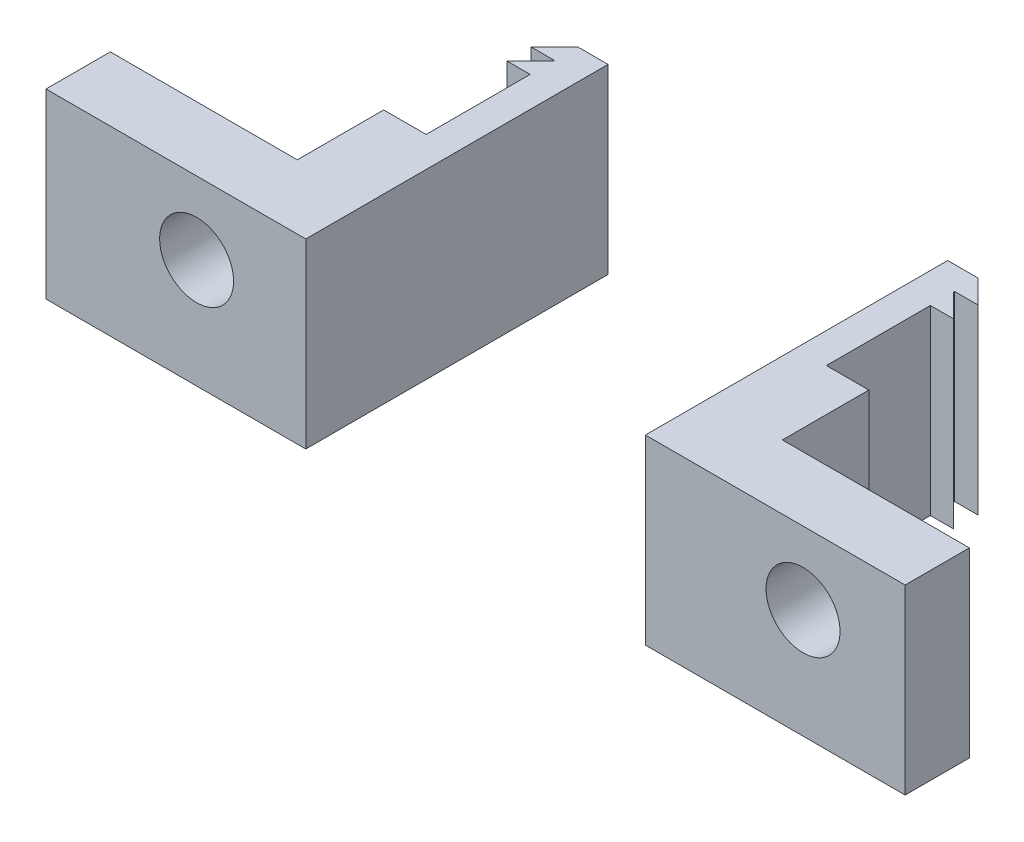
from build123d import *

# Parameters (mm, degrees)
BOSS_EXTRUDE1_DEPTH = 15
SKETCH3_R           = 3.05
CUT_EXTRUDE1_DEPTH  = 15
CUT_EXTRUDE2_DEPTH  = 59.485528143
SKETCH5_R           = 6
CUT_EXTRUDE3_DEPTH  = 10
SKETCH6_W           = 24.925
SKETCH6_H           = 15
BOSS_EXTRUDE2_DEPTH = 1
SKETCH7_W           = 24.925
SKETCH7_H           = 15
BOSS_EXTRUDE3_DEPTH = 1


with BuildPart() as part:
    # Sketch2 → Boss-Extrude1 (new body)
    with BuildSketch(Plane(origin=(0, 0, 0), x_dir=(1, 0, 0), z_dir=(0, 1, 0))):
        Polygon((-13.5, 0), (6.5, 0), (11.5, -5), (11.5, -41), (31.917309801, -41), (31.917309801, -35.69895288), (16.5, -35.69895288), (16.5, 5), (-23.5, 5), (-23.5, -35.69895288), (-38.917309801, -35.69895288), (-38.917309801, -41), (-18.5, -41), (-18.5, -5), align=None)
    extrude(amount=BOSS_EXTRUDE1_DEPTH)

    # Sketch3 → Cut-Extrude1 (cut)
    with BuildSketch(Plane(origin=(0, 0, 35.69895288), x_dir=(-1, 0, 0), z_dir=(0, 0, -1))):
        with Locations((26.5, 9)):
            Circle(SKETCH3_R)
        with Locations((-23.5, 9)):
            Circle(SKETCH3_R)
    extrude(amount=-CUT_EXTRUDE1_DEPTH, mode=Mode.SUBTRACT)

    # Sketch4 → Cut-Extrude2 (cut, through all)
    with BuildSketch(Plane(origin=(0, 15, 0), x_dir=(1, 0, 0), z_dir=(0, 1, 0))):
        Polygon((-20, -16.075), (-18.422599161, -16.075), (11.422599161, -16.075), (13, -16.075), (14.925, -18), (13, -18), (13, -18.075), (14.925, -20), (13, -20), (13, -28.575), (16.5, -28.575), (24.862996202, -28.575), (24.862996202, 6.300085517), (-33.250787424, 6.300085517), (-33.250787424, -28.575), (-23.5, -28.575), (-20, -28.575), (-20, -20), (-21.925, -20), (-20, -18.075), (-20, -18), (-21.925, -18), align=None)
    extrude(amount=-CUT_EXTRUDE2_DEPTH, mode=Mode.SUBTRACT)


with BuildPart() as cut_extrude2_piece_1:
    # of the separate pieces the step leaves, piece 1, a body of its own (cut_extrude2_pieces)
    add(part.part.solids().sort_by_distance((11.5, 0, 16.075))[0])

    # Sketch7 → Boss-Extrude3 (add)
    with BuildSketch(Plane.ZY.offset(-11.5)):
        with Locations((28.5375, 7.5)):
            Rectangle(SKETCH7_W, SKETCH7_H)
    extrude(amount=BOSS_EXTRUDE3_DEPTH)


with BuildPart() as cut_extrude2_piece_2:
    # of the separate pieces the step leaves, piece 2, a body of its own (cut_extrude2_pieces)
    add(part.part.solids().sort_by_distance((-18.5, 0, 41))[0])

    # Sketch5 → Cut-Extrude3 (cut)
    with BuildSketch(Plane(origin=(0, 0, 35.69895288), x_dir=(-1, 0, 0), z_dir=(0, 0, -1))):
        with Locations((26.5, 9)):
            Circle(SKETCH5_R)
    extrude(amount=CUT_EXTRUDE3_DEPTH, mode=Mode.SUBTRACT)

    # Sketch6 → Boss-Extrude2 (add)
    with BuildSketch(Plane(origin=(-18.5, 0, 0), x_dir=(0, 0, -1), z_dir=(1, 0, 0))):
        with Locations((-28.5375, 7.5)):
            Rectangle(SKETCH6_W, SKETCH6_H)
    extrude(amount=BOSS_EXTRUDE2_DEPTH)


solid = Compound([cut_extrude2_piece_1.part, cut_extrude2_piece_2.part])
